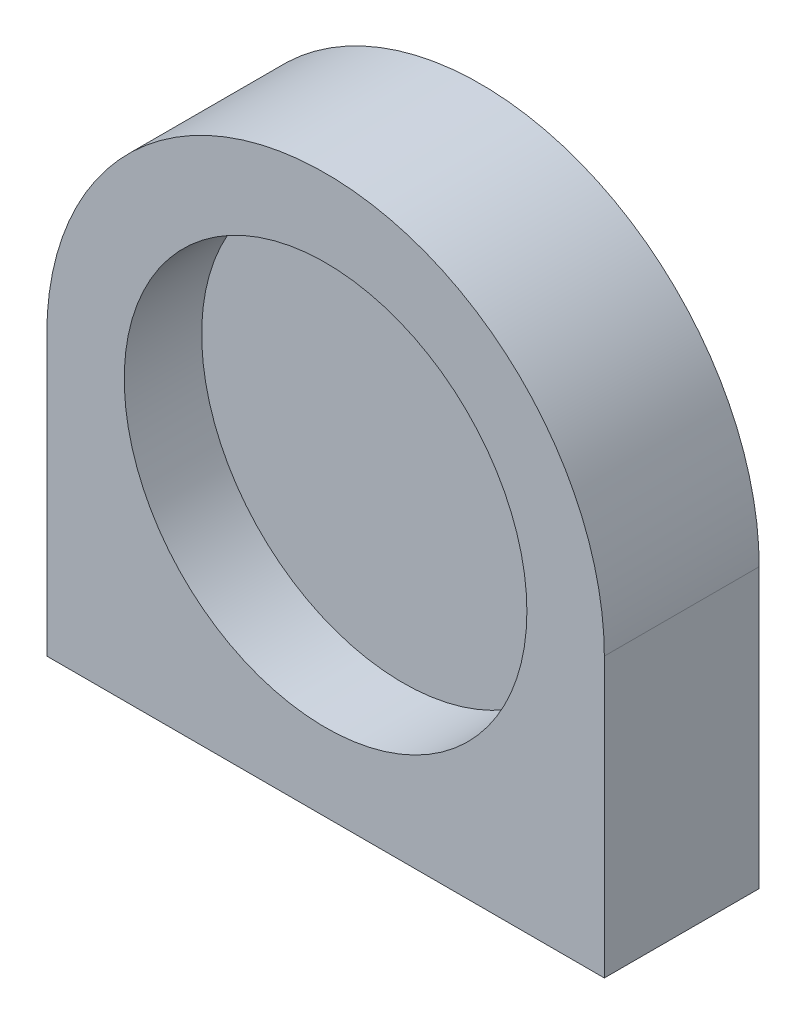
from build123d import *

# Parameters (mm, degrees)
SKETCH_1_R      = 6.5
EXTRUDE_1_DEPTH = 2.5
EXTRUDE_START   = 2.5
EXTRUDE_2_DEPTH = 2.5


with BuildPart() as part:
    # 草图1 → 凸台-拉伸1 (new body)
    with BuildSketch(Plane.XY):
        with BuildLine():
            Line((-9, 0), (-9, -9))
            Line((-9, -9), (9, -9))
            Line((9, -9), (9, 0))
            ThreePointArc((9, 0), (0, 9), (-9, 0))
        make_face()
        Circle(SKETCH_1_R, mode=Mode.SUBTRACT)
    extrude(amount=EXTRUDE_1_DEPTH)

    # 草图2 → 凸台-拉伸2 (add)
    with BuildSketch(Plane(origin=(0, 0, 0), x_dir=(-1, 0, 0), z_dir=(0, 0, -1)).offset(EXTRUDE_START)):
        with BuildLine():
            Line((-9, 0), (-9, -9))
            Line((-9, -9), (9, -9))
            Line((9, -9), (9, 0))
            ThreePointArc((9, 0), (0, 9), (-9, 0))
        make_face()
    extrude(amount=-EXTRUDE_2_DEPTH)


solid = part.part
